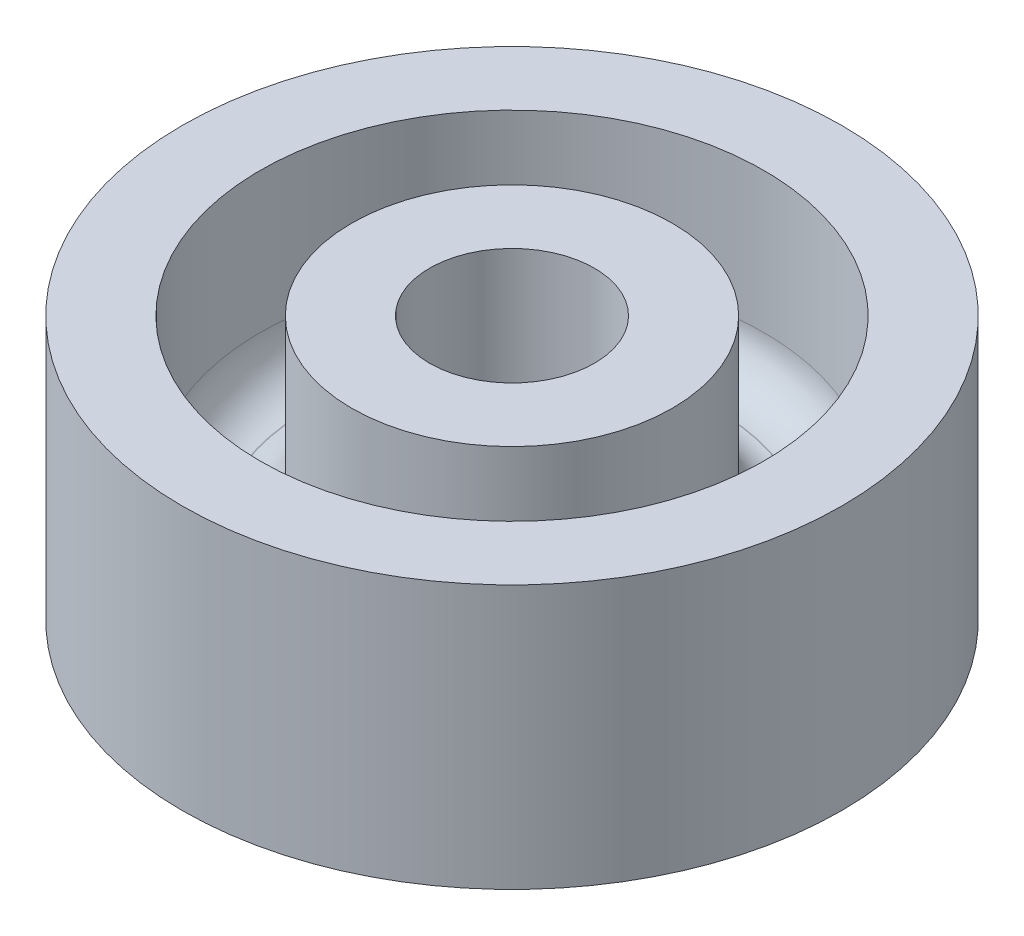
from build123d import *

# Parameters (mm, degrees)
SKETCH1_R           = 12.7
BOSS_EXTRUDE1_DEPTH = 10.16
SKETCH2_R           = 9.7
SKETCH2_R_2         = 6.175
SKETCH2_R_3         = 3.175
CUT_EXTRUDE1_DEPTH  = 7.16
FILLET1_R           = 1.75


with BuildPart() as part:
    # Sketch1 → Boss-Extrude1 (new body)
    with BuildSketch(Plane(origin=(0, 0, 0), x_dir=(1, 0, 0), z_dir=(0, 1, 0))):
        with Locations(Location((0, 0, 0), (0, 0, 270))):
            Circle(SKETCH1_R)
    extrude(amount=BOSS_EXTRUDE1_DEPTH)

    # Sketch2 → Cut-Extrude1 (cut)
    # profile 1 of 2: a face of its own
    with BuildSketch(Plane(origin=(0, 10.16, 0), x_dir=(1, 0, 0), z_dir=(0, 1, 0))):
        with Locations(Location((0, 0, 0), (0, 0, 270))):
            Circle(SKETCH2_R)
        with Locations(Location((0, 0, 0), (0, 0, 270))):
            Circle(SKETCH2_R_2, mode=Mode.SUBTRACT)
    # profile 2 of 2: a face of its own
    with BuildSketch(Plane(origin=(0, 10.16, 0), x_dir=(1, 0, 0), z_dir=(0, 1, 0))):
        with Locations(Location((0, 0, 0), (0, 0, 270))):
            Circle(SKETCH2_R_3)
    extrude(amount=-CUT_EXTRUDE1_DEPTH, mode=Mode.SUBTRACT)

    # Fillet1
    fillet1_edges = [part.edges().sort_by_distance(p)[0] for p in [
        (0, 3, -6.175),
        (0, 3, -9.7),
    ]]
    fillet(fillet1_edges, radius=FILLET1_R)


solid = part.part
